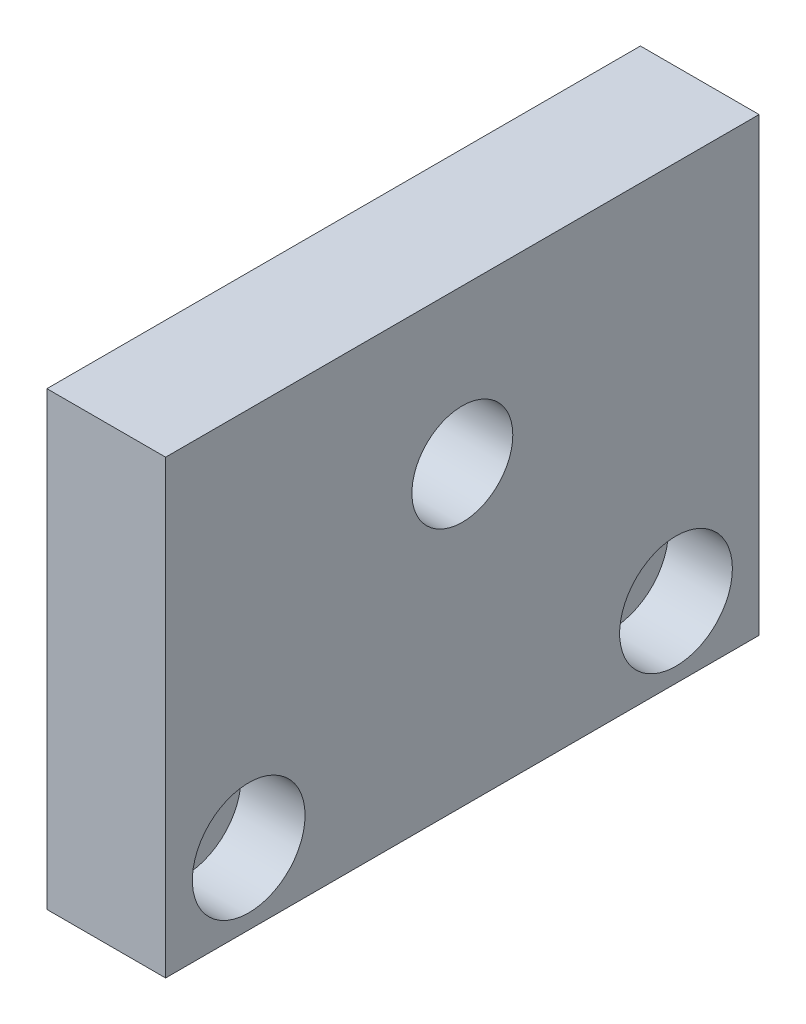
from build123d import *

# Parameters (mm, degrees)
SKETCH1_W                                       = 50
SKETCH1_H                                       = 38
BOSS_EXTRUDE1_DEPTH                             = 10
M10X1_5_TAPPED_HOLE1_D                          = 8.5
CBORE_FOR_M5_SOCKET_HEAD_CAP_SCREW1_D           = 5.5
CBORE_FOR_M5_SOCKET_HEAD_CAP_SCREW1_CBORE_D     = 9.5
CBORE_FOR_M5_SOCKET_HEAD_CAP_SCREW1_CBORE_DEPTH = 5.4


with BuildPart() as part:
    # Sketch1 → Boss-Extrude1 (new body)
    with BuildSketch(Plane(origin=(0, 0, 0), x_dir=(0, 0, -1), z_dir=(1, 0, 0))):
        with Locations((0, 19)):
            Rectangle(SKETCH1_W, SKETCH1_H)
    extrude(amount=BOSS_EXTRUDE1_DEPTH)

    # M10x1.5 Tapped Hole1 (through all)
    with Locations(Plane(origin=(10, 0, 0), x_dir=(0, 0, -1), z_dir=(1, 0, 0))):
        with Locations((0, 25)):
            Hole(M10X1_5_TAPPED_HOLE1_D / 2)

    # CBORE for M5 Socket Head Cap Screw1 (through all)
    with Locations(Plane(origin=(10, 0, 0), x_dir=(0, 0, -1), z_dir=(1, 0, 0))):
        with Locations((18, 6), (-18, 6)):
            CounterBoreHole(CBORE_FOR_M5_SOCKET_HEAD_CAP_SCREW1_D / 2, CBORE_FOR_M5_SOCKET_HEAD_CAP_SCREW1_CBORE_D / 2, CBORE_FOR_M5_SOCKET_HEAD_CAP_SCREW1_CBORE_DEPTH)


solid = part.part
